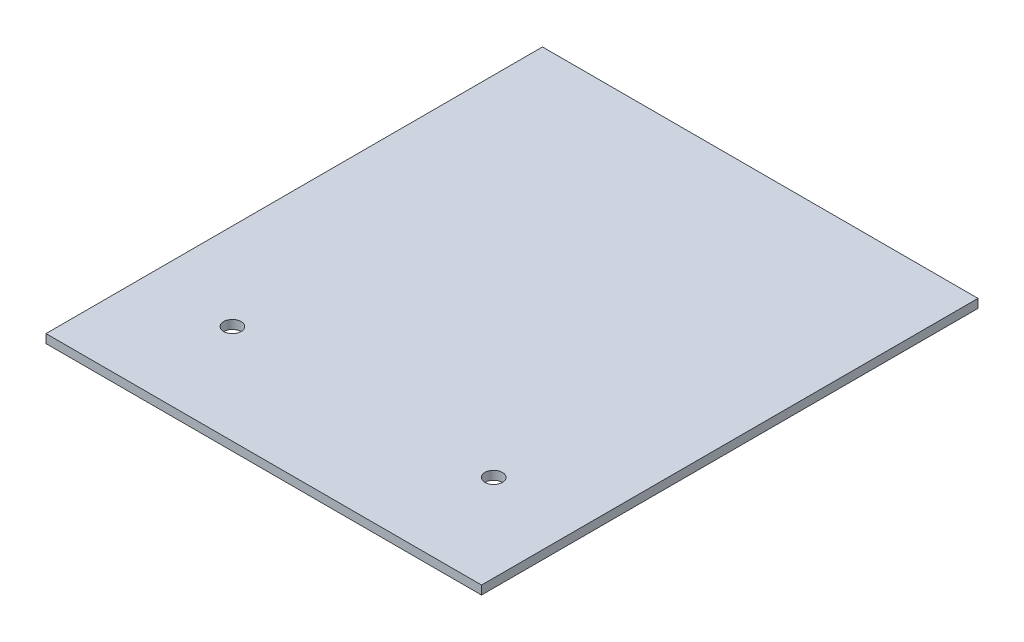
from build123d import *

# Parameters (mm, degrees)
SKETCH_1_W      = 250
SKETCH_1_H      = 285
SKETCH_1_R      = 5
EXTRUDE_1_DEPTH = 5


with BuildPart() as part:
    # 草图1 → 凸台-拉伸1 (new body)
    with BuildSketch(Plane(origin=(0, 0, 0), x_dir=(1, 0, 0), z_dir=(0, 1, 0))):
        Rectangle(SKETCH_1_W, SKETCH_1_H)
        with Locations(Location((-75, -85.5, 0), (0, 0, 270))):
            Circle(SKETCH_1_R, mode=Mode.SUBTRACT)
        with Locations(Location((75, -85.5, 0), (0, 0, 270))):
            Circle(SKETCH_1_R, mode=Mode.SUBTRACT)
    extrude(amount=EXTRUDE_1_DEPTH)


solid = part.part
